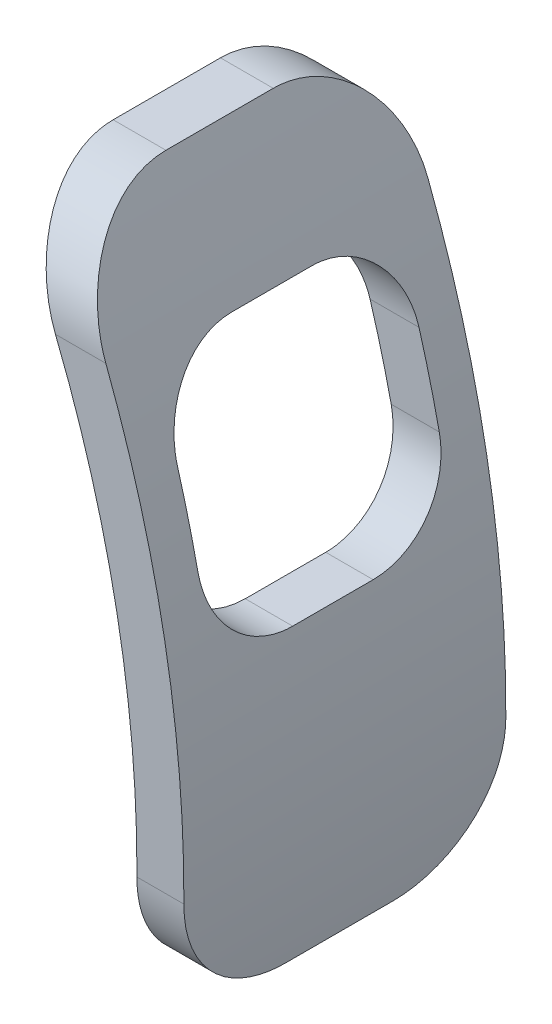
from build123d import *

# Parameters (mm, degrees)
BOSS_EXTRUDE2_DEPTH     = 609.6
FILLET1_R               = 203.2
CUT_EXTRUDE1_DEPTH      = 2530.244458167
CUT_EXTRUDE1_DEPTH_BACK = 2530.244458167


with BuildPart() as part:
    # Sketch1 → Boss-Extrude2 (new body)
    with BuildSketch(Plane.XY):
        with BuildLine():
            Line((1903.109301748, 1003.3), (2003.058558405, 1003.3))
            ThreePointArc((2003.058558405, 1003.3), (2202.497656801, 409.705443199), (2229.852387132, -215.9))
            Line((2229.852387132, -215.9), (2140.519351559, -215.9))
            ThreePointArc((2140.519351559, -215.9), (2111.716205237, 411.206241365), (1903.109301748, 1003.3))
        make_face()
    extrude(amount=BOSS_EXTRUDE2_DEPTH)

    # Fillet1
    fillet1_edges = [part.edges().sort_by_distance(p)[0] for p in [
        (2185.185869346, -215.9, 609.6),
        (2185.185869346, -215.9, 0),
        (1953.083930077, 1003.3, 0),
        (1953.083930077, 1003.3, 609.6),
    ]]
    fillet(fillet1_edges, radius=FILLET1_R)

    # Sketch2 → Cut-Extrude1 (cut, two sides: drawn at the far end of the back side and taken through both)
    with BuildSketch(Plane(origin=(0, 0, 0), x_dir=(0, 0, -1), z_dir=(1, 0, 0)).offset(-CUT_EXTRUDE1_DEPTH_BACK)):
        with BuildLine():
            Line((-381, 317.5), (-228.6, 317.5))
            ThreePointArc((-228.6, 317.5), (-120.836926547, 362.136926547), (-76.2, 469.9))
            Line((-76.2, 469.9), (-76.2, 622.3))
            ThreePointArc((-76.2, 622.3), (-120.836926547, 730.063073453), (-228.6, 774.7))
            Line((-228.6, 774.7), (-381, 774.7))
            ThreePointArc((-381, 774.7), (-488.763073453, 730.063073453), (-533.4, 622.3))
            Line((-533.4, 622.3), (-533.4, 469.9))
            ThreePointArc((-533.4, 469.9), (-488.763073453, 362.136926547), (-381, 317.5))
        make_face()
    extrude(amount=CUT_EXTRUDE1_DEPTH + CUT_EXTRUDE1_DEPTH_BACK, mode=Mode.SUBTRACT)


solid = part.part
